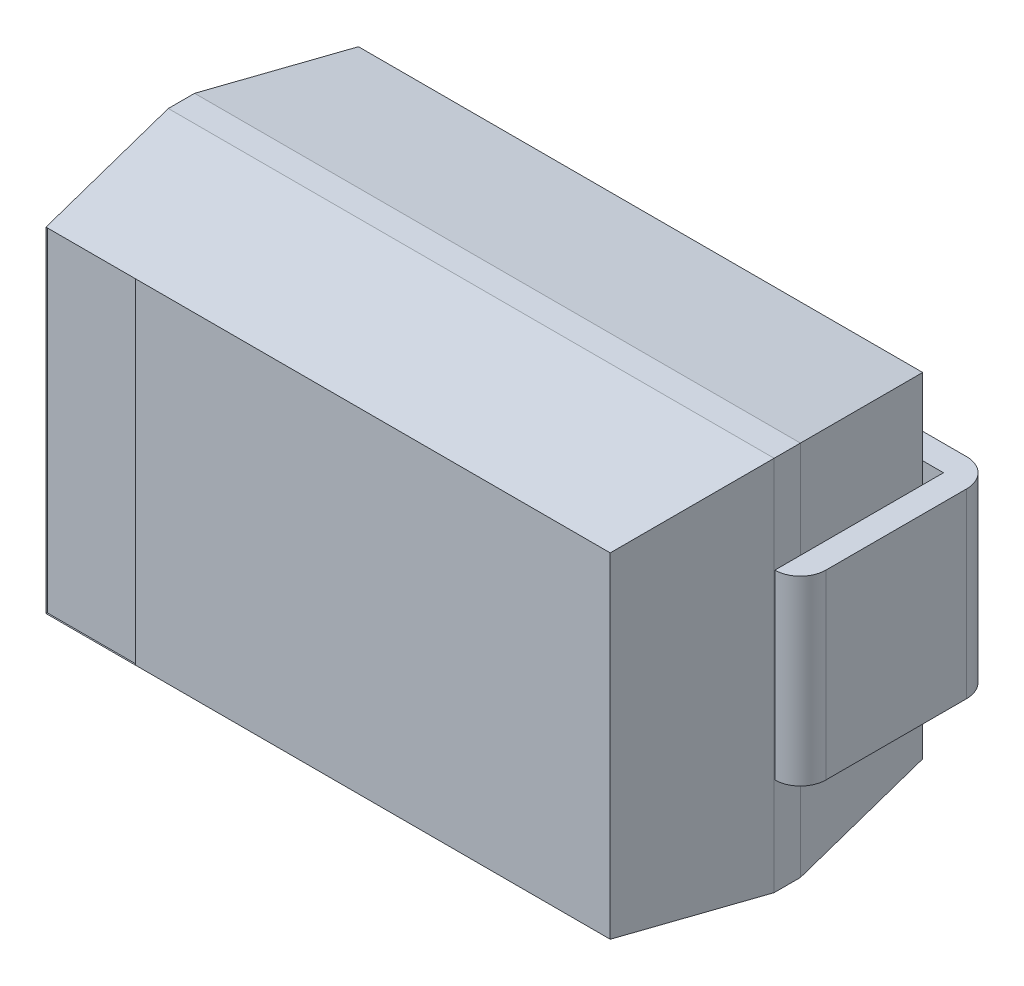
from build123d import *
from OCP.BRepFilletAPI import BRepFilletAPI_MakeChamfer

# Parameters (mm, degrees)
SKETCH_1_W           = 4.75
SKETCH_1_H           = 2.95
EXTRUDE_1_DEPTH      = 2.45
CHAMFER_1_SIZE       = 1.122
CHAMFER_1_SIZE2      = 0.163
CHAMFER_2_SIZE       = 0.163
CHAMFER_2_SIZE2      = 1.122
EXTRUDE_2_DEPTH      = 0.7125
EXTRUDE_2_DEPTH_BACK = 0.7125
SKETCH_3_W           = 0.7
SKETCH_3_H           = 2.624
CUT_EXTRUDE_1_DEPTH  = 0.01


with BuildPart() as part:
    # Эскиз1 → Бобышка-Вытянуть1 (new body)
    with BuildSketch(Plane.XY.offset(0.2)):
        Rectangle(SKETCH_1_W, SKETCH_1_H)
    extrude(amount=EXTRUDE_1_DEPTH)

    # Фаска1: one chamfer whose edges measure the first distance from different faces: ONE call of the kernel's chamfer builder (chamfer() names one face for all edges)
    chamfer_1_edges_1 = [part.edges().sort_by_distance(p)[0] for p in [
        (-2.375, 0, 2.65),
    ]]
    chamfer_1_side_1 = [part.faces().sort_by_distance(p)[0] for p in [
        (-2.375, 0, 1.425),
    ]]
    chamfer_1_edges_2 = [part.edges().sort_by_distance(p)[0] for p in [
        (0, -1.475, 2.65),
    ]]
    chamfer_1_side_2 = [part.faces().sort_by_distance(p)[0] for p in [
        (0, -1.475, 1.425),
    ]]
    chamfer_1_edges_3 = [part.edges().sort_by_distance(p)[0] for p in [
        (2.375, 0, 2.65),
    ]]
    chamfer_1_side_3 = [part.faces().sort_by_distance(p)[0] for p in [
        (2.375, 0, 1.425),
    ]]
    chamfer_1_edges_4 = [part.edges().sort_by_distance(p)[0] for p in [
        (0, 1.475, 2.65),
    ]]
    chamfer_1_side_4 = [part.faces().sort_by_distance(p)[0] for p in [
        (0, 1.475, 1.425),
    ]]
    chamfer_1 = BRepFilletAPI_MakeChamfer(part.part.solid().wrapped)
    for e in chamfer_1_edges_1:
        chamfer_1.Add(CHAMFER_1_SIZE, CHAMFER_1_SIZE2, e.wrapped, chamfer_1_side_1[0].wrapped)  # the first distance lies on this face
    for e in chamfer_1_edges_2:
        chamfer_1.Add(CHAMFER_1_SIZE, CHAMFER_1_SIZE2, e.wrapped, chamfer_1_side_2[0].wrapped)  # the first distance lies on this face
    for e in chamfer_1_edges_3:
        chamfer_1.Add(CHAMFER_1_SIZE, CHAMFER_1_SIZE2, e.wrapped, chamfer_1_side_3[0].wrapped)  # the first distance lies on this face
    for e in chamfer_1_edges_4:
        chamfer_1.Add(CHAMFER_1_SIZE, CHAMFER_1_SIZE2, e.wrapped, chamfer_1_side_4[0].wrapped)  # the first distance lies on this face
    add(Compound.cast(chamfer_1.Shape()), mode=Mode.REPLACE)

    # Фаска2
    chamfer_2_edges = [part.edges().sort_by_distance(p)[0] for p in [
        (0, -1.475, 0.2),
        (-2.375, 0, 0.2),
        (0, 1.475, 0.2),
        (2.375, 0, 0.2),
    ]]
    chamfer_2_side = [part.faces().sort_by_distance(p)[0] for p in [
        (0, 0, 0.2),
    ]]
    chamfer(chamfer_2_edges, length=CHAMFER_2_SIZE, length2=CHAMFER_2_SIZE2, reference=chamfer_2_side[0])

    # Эскиз3 → Вырез-Вытянуть1 (cut)
    with BuildSketch(Plane.XY.offset(2.65)):
        with Locations((-1.862, 0)):
            Rectangle(SKETCH_3_W, SKETCH_3_H)
    extrude(amount=-CUT_EXTRUDE_1_DEPTH, mode=Mode.SUBTRACT)


with BuildPart() as body_2:
    # Эскиз2 → Бобышка-Вытянуть2 (new, two sides: drawn at the far end of the back side and taken through both)
    with BuildSketch(Plane(origin=(0, 0, 0), x_dir=(1, 0, 0), z_dir=(0, 1, 0)).offset(-EXTRUDE_2_DEPTH_BACK)):
        with BuildLine():
            Line((-2.375, -0.2), (-2.375, -1.322))
            Line((-2.375, -1.322), (-2.375, -1.522))
            ThreePointArc((-2.375, -1.522), (-2.516421356, -1.463421356), (-2.575, -1.322))
            Line((-2.575, -1.322), (-2.575, -0.22))
            ThreePointArc((-2.575, -0.22), (-2.510563492, -0.064436508), (-2.355, 0))
            Line((-2.355, 0), (-1.44, 0))
            Line((-1.44, 0), (-1.44, -0.2))
            Line((-1.44, -0.2), (-2.375, -0.2))
        make_face()
    extrude(amount=EXTRUDE_2_DEPTH + EXTRUDE_2_DEPTH_BACK)


with BuildPart() as body_3:
    # Зеркальное отражение1: mirrored copy
    add(body_2.part.mirror(Plane(origin=(0, 0, 0), x_dir=(0, 0, 1), z_dir=(1, 0, 0))))


solid = Compound([part.part, body_2.part, body_3.part])
